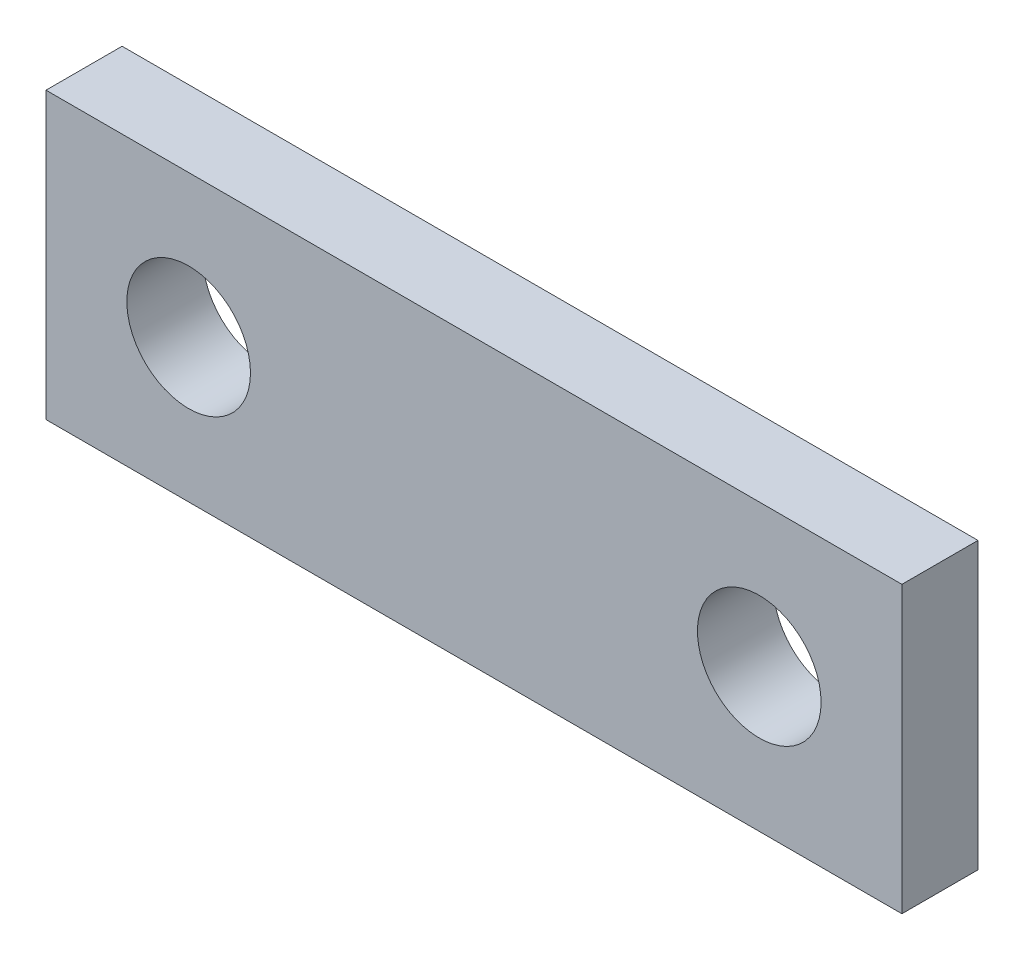
from build123d import *

# Parameters (mm, degrees)
SKETCH_1_W      = 90
SKETCH_1_H      = 30
SKETCH_1_R      = 6.5
EXTRUDE_1_DEPTH = 8


with BuildPart() as part:
    # 草图1 → 凸台-拉伸1 (new body)
    with BuildSketch(Plane.XY):
        with Locations((45, 15)):
            Rectangle(SKETCH_1_W, SKETCH_1_H)
        with Locations((15, 15)):
            Circle(SKETCH_1_R, mode=Mode.SUBTRACT)
        with Locations((75, 15)):
            Circle(SKETCH_1_R, mode=Mode.SUBTRACT)
    extrude(amount=EXTRUDE_1_DEPTH)


solid = part.part
